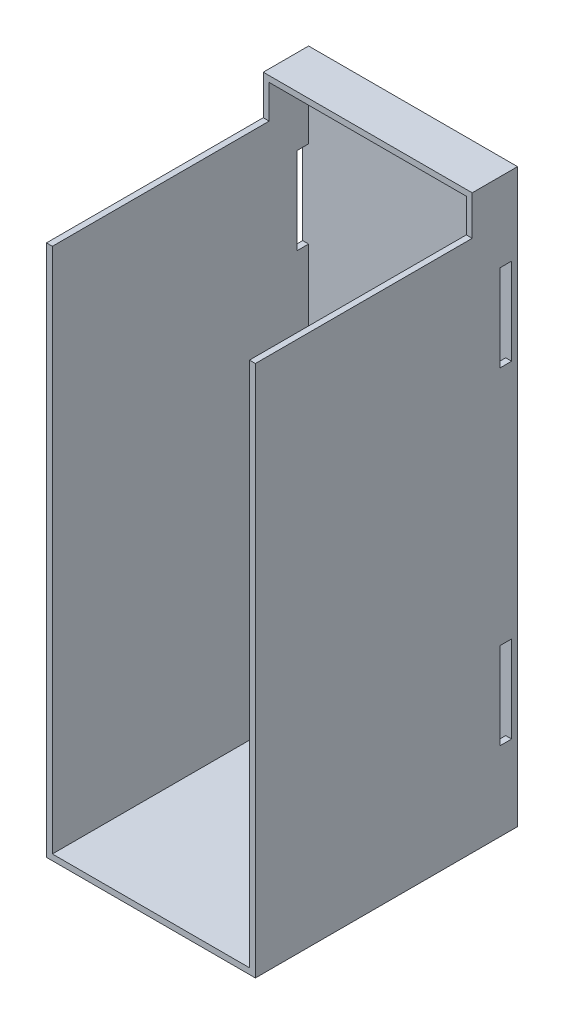
from build123d import *

# Parameters (mm, degrees)
SKETCH_1_W          = 53
SKETCH_1_H          = 145
EXTRUDE_1_DEPTH     = 1.5
EXTRUDE_2_DEPTH     = 65
SKETCH_3_W          = 50
SKETCH_3_H          = 1.5
EXTRUDE_3_DEPTH     = 10
SKETCH_4_W          = 3
SKETCH_4_H          = 22
CUT_EXTRUDE_1_DEPTH = 100
SKETCH_5_W          = 55
SKETCH_5_H          = 10
CUT_EXTRUDE_2_DEPTH = 100


with BuildPart() as part:
    # Эскиз1 → Бобышка-Вытянуть1 (new body)
    with BuildSketch(Plane.XY):
        with Locations((26.5, 72.5)):
            Rectangle(SKETCH_1_W, SKETCH_1_H)
    extrude(amount=EXTRUDE_1_DEPTH)

    # Эскиз2 → Бобышка-Вытянуть2 (add)
    with BuildSketch(Plane.XY.offset(1.5)):
        Polygon((1.5, 145), (1.5, 1.5), (51.5, 1.5), (51.5, 145), (53, 145), (53, 0), (0, 0), (0, 145), align=None)
    extrude(amount=EXTRUDE_2_DEPTH)

    # Эскиз3 → Бобышка-Вытянуть3 (add)
    with BuildSketch(Plane.XY.offset(1.5)):
        with Locations((26.5, 144.25)):
            Rectangle(SKETCH_3_W, SKETCH_3_H)
    extrude(amount=EXTRUDE_3_DEPTH)

    # Эскиз4 → Вырез-Вытянуть1 (cut)
    with BuildSketch(Plane(origin=(53, 0, 0), x_dir=(0, 0, -1), z_dir=(1, 0, 0))):
        with Locations((-3, 114)):
            Rectangle(SKETCH_4_W, SKETCH_4_H)
        with Locations((-3, 31)):
            Rectangle(SKETCH_4_W, SKETCH_4_H)
    extrude(amount=-CUT_EXTRUDE_1_DEPTH, mode=Mode.SUBTRACT)

    # Эскиз5 → Вырез-Вытянуть2 (cut)
    with BuildSketch(Plane(origin=(53, 0, 0), x_dir=(0, 0, -1), z_dir=(1, 0, 0))):
        with Locations((-39, 140)):
            Rectangle(SKETCH_5_W, SKETCH_5_H)
    extrude(amount=-CUT_EXTRUDE_2_DEPTH, mode=Mode.SUBTRACT)


solid = part.part
